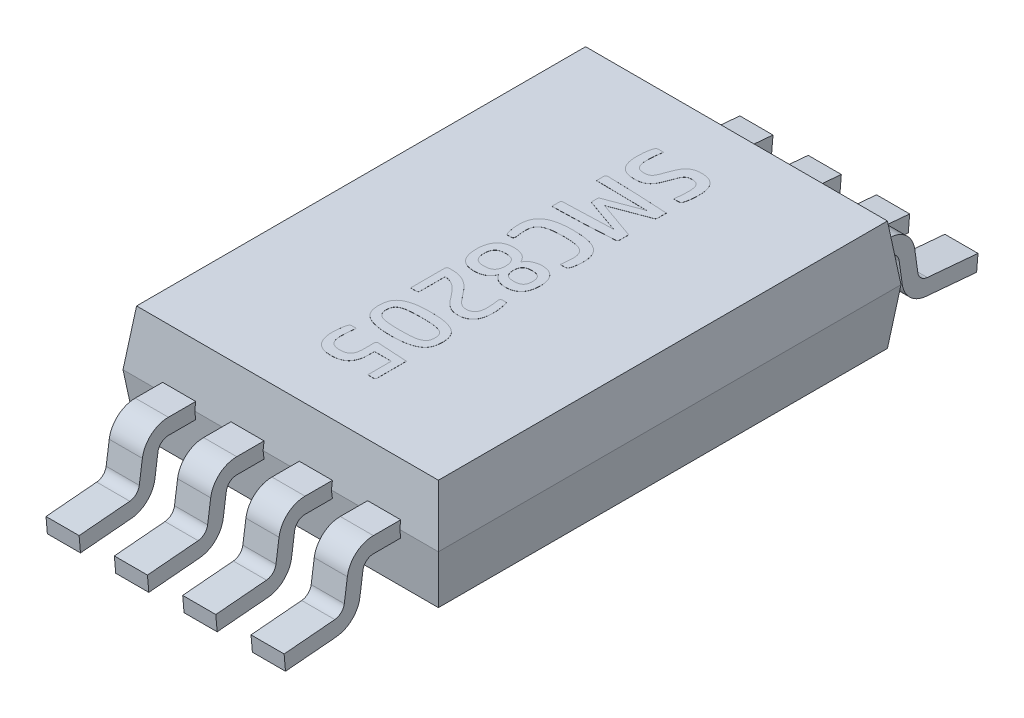
from build123d import *

# Parameters (mm, degrees)
SKETCH1_W                = 3
SKETCH1_H                = 4.4
EXTRUDE1_DEPTH           = 0.525
EXTRUDE1_TAPER           = 7
EXTRUDE1_OTHER_WAY_DEPTH = 0.525
EXTRUDE1_OTHER_WAY_TAPER = 7
EXTRUDE3_DEPTH           = 0.1575
LPATTERN1_COUNT          = 4
LPATTERN1_PITCH          = 0.65
BOSS_EXTRUDE1_DEPTH      = 0.001


with BuildPart() as part:
    # Sketch1 → Extrude1 (new body)
    with BuildSketch(Plane(origin=(0, 0, 0), x_dir=(1, 0, 0), z_dir=(0, 1, 0))):
        Rectangle(SKETCH1_W, SKETCH1_H)
    extrude(amount=EXTRUDE1_DEPTH, taper=EXTRUDE1_TAPER)

    # Sketch1 → Extrude1 other way (add)
    with BuildSketch(Plane(origin=(0, 0, 0), x_dir=(1, 0, 0), z_dir=(0, 1, 0))):
        Rectangle(SKETCH1_W, SKETCH1_H)
    extrude(amount=-EXTRUDE1_OTHER_WAY_DEPTH, taper=EXTRUDE1_OTHER_WAY_TAPER)

    # Sketch5 → Extrude3 (add, symmetric)
    with BuildSketch(Plane(origin=(0.975, 0, 0), x_dir=(0, 0, -1), z_dir=(1, 0, 0))):
        with BuildLine():
            Line((0, 0.075), (-2.450973193, 0.075))
            ThreePointArc((-2.450973193, 0.075), (-2.61498795, 0.013677395), (-2.69854021, -0.140206725))
            Line((-2.69854021, -0.140206725), (-2.727701519, -0.347700215))
            ThreePointArc((-2.727701519, -0.347700215), (-2.757892868, -0.406320342), (-2.818012751, -0.433402375))
            Line((-2.818012751, -0.433402375), (-3.3, -0.475570795))
            Line((-3.3, -0.475570795), (-3.286926639, -0.625))
            Line((-3.286926639, -0.625), (-2.80493939, -0.58283158))
            ThreePointArc((-2.80493939, -0.58283158), (-2.654639682, -0.515126498), (-2.579161308, -0.36857618))
            Line((-2.579161308, -0.36857618), (-2.55, -0.16108269))
            ThreePointArc((-2.55, -0.16108269), (-2.516579096, -0.099529042), (-2.450973193, -0.075))
            Line((-2.450973193, -0.075), (0, -0.075))
            Line((0, -0.075), (2.450973193, -0.075))
            ThreePointArc((2.450973193, -0.075), (2.516579096, -0.099529042), (2.55, -0.16108269))
            Line((2.55, -0.16108269), (2.579161308, -0.36857618))
            ThreePointArc((2.579161308, -0.36857618), (2.654639682, -0.515126498), (2.80493939, -0.58283158))
            Line((2.80493939, -0.58283158), (3.286926639, -0.625))
            Line((3.286926639, -0.625), (3.3, -0.475570795))
            Line((3.3, -0.475570795), (2.818012751, -0.433402375))
            ThreePointArc((2.818012751, -0.433402375), (2.757892868, -0.406320342), (2.727701519, -0.347700215))
            Line((2.727701519, -0.347700215), (2.69854021, -0.140206725))
            ThreePointArc((2.69854021, -0.140206725), (2.61498795, 0.013677395), (2.450973193, 0.075))
            Line((2.450973193, 0.075), (0, 0.075))
        make_face()
    extrude3 = extrude(amount=EXTRUDE3_DEPTH, both=True)

    # LPattern1: Extrude3 ×4
    with Locations(*[(-i * LPATTERN1_PITCH, 0, 0) for i in range(1, LPATTERN1_COUNT)]):
        add(extrude3)

    # Sketch6 → Boss-Extrude1 (add)
    # profile 1 of 7: a face of its own
    with BuildSketch(Plane(origin=(0, 0.525, 0), x_dir=(1, 0, 0), z_dir=(0, 1, 0))):
        with BuildLine():
            add(Edge.make_bspline(
                [(0.162381134, 1.644), (0.169054986, 1.643869102), (0.181984652, 1.643615505), (0.200714968, 1.64129083), (0.218215319, 1.637704043), (0.234512594, 1.632701821), (0.249404001, 1.625793179), (0.26309645, 1.617674346), (0.275647201, 1.608153856), (0.286680279, 1.596872091), (0.296530112, 1.584137922), (0.305035836, 1.569760509), (0.312273852, 1.553836167), (0.318175721, 1.536289554), (0.322586538, 1.517100452), (0.325777033, 1.496335871), (0.327843774, 1.473958219), (0.328033076, 1.458504837), (0.328131134, 1.4505)],
                knots=[0, 0, 0, 0, 1.095800708, 2.122962473, 3.094754318, 4.027666979, 4.915798918, 5.784359854, 6.638537801, 7.495125128, 8.368499264, 9.276966768, 10.23249998, 11.23671904, 12.312438126, 13.462383652, 14.685517265, 16, 16, 16, 16], degree=3))
            add(Edge.make_bspline(
                [(0.328131134, 1.4505), (0.327938044, 1.438240589), (0.327551018, 1.413668039), (0.324357064, 1.383382869), (0.321075141, 1.360289978), (0.31840571, 1.345001791), (0.315296382, 1.331827021), (0.312875015, 1.323823375), (0.311756134, 1.320125)],
                knots=[0, 0, 0, 0, 1.673425632, 3.354185213, 4.153136237, 4.858420781, 5.472491874, 6, 6, 6, 6], degree=3))
            add(Edge.make_bspline(
                [(0.311756134, 1.320125), (0.310745015, 1.317957822), (0.30888589, 1.313973072), (0.305284566, 1.309030144), (0.301723025, 1.305229068), (0.296439058, 1.302123932), (0.288982973, 1.300445378), (0.282926861, 1.30015305), (0.279756134, 1.3)],
                knots=[0, 0, 0, 0, 1.050800235, 1.93208732, 2.684913886, 3.327117359, 4.60059074, 6, 6, 6, 6], degree=3))
            Line((0.279756134, 1.3), (0.237756134, 1.3))
            add(Edge.make_bspline(
                [(0.237756134, 1.3), (0.239132118, 1.310661597), (0.241912861, 1.332207753), (0.24534305, 1.365030852), (0.247724931, 1.398715436), (0.247994834, 1.421495888), (0.248131134, 1.433)],
                knots=[0, 0, 0, 0, 0.966222987, 1.952652248, 2.966090828, 4, 4, 4, 4], degree=3))
            add(Edge.make_bspline(
                [(0.248131134, 1.433), (0.248052349, 1.438292897), (0.247901451, 1.448430383), (0.246954837, 1.462961946), (0.245200381, 1.476106819), (0.242882691, 1.487946568), (0.239800614, 1.498522221), (0.236461603, 1.50808634), (0.232124364, 1.516364447), (0.227382542, 1.523644758), (0.221910822, 1.529771635), (0.216063799, 1.535197968), (0.209285833, 1.539294574), (0.201962586, 1.542556408), (0.194032938, 1.545053179), (0.185487259, 1.546789387), (0.176320542, 1.547766764), (0.170008444, 1.54792069), (0.166756134, 1.548)],
                knots=[0, 0, 0, 0, 1.566546384, 3.000406381, 4.306680085, 5.489289946, 6.566592238, 7.565373354, 8.480904255, 9.325684365, 10.12960443, 10.906884774, 11.676793639, 12.460600545, 13.27569779, 14.131832139, 15.037426299, 16, 16, 16, 16], degree=3))
            add(Edge.make_bspline(
                [(0.166756134, 1.548), (0.163127735, 1.5479372), (0.15622665, 1.547817757), (0.146353953, 1.54667509), (0.13746434, 1.544850424), (0.129421004, 1.542223238), (0.122146111, 1.53864576), (0.115412304, 1.53410717), (0.109300153, 1.528360896), (0.103501411, 1.52174042), (0.098277341, 1.513919807), (0.093095072, 1.505218284), (0.088465095, 1.495258524), (0.083763411, 1.484363452), (0.079383769, 1.472149293), (0.074273756, 1.458846427), (0.069117311, 1.444031444), (0.065431371, 1.433746843), (0.063506134, 1.428375)],
                knots=[0, 0, 0, 0, 1.005517589, 1.912458331, 2.750668255, 3.517732371, 4.2512769, 4.991340343, 5.759794698, 6.57041129, 7.42587322, 8.362913622, 9.375505192, 10.467530105, 11.651811884, 12.97128634, 14.418045237, 16, 16, 16, 16], degree=3))
            add(Edge.make_bspline(
                [(0.063506134, 1.428375), (0.059244336, 1.417387998), (0.051082423, 1.396346422), (0.040130912, 1.370982501), (0.030917092, 1.352386099), (0.023110457, 1.339881484), (0.014566106, 1.328284556), (0.005226349, 1.317626031), (-0.005101865, 1.308057878), (-0.016420393, 1.299539228), (-0.029014862, 1.292499814), (-0.042685479, 1.28636692), (-0.057880853, 1.281530747), (-0.074940985, 1.27849017), (-0.093767462, 1.276233513), (-0.106986026, 1.276079956), (-0.113868866, 1.276)],
                knots=[0, 0, 0, 0, 1.935271406, 3.706303315, 4.535645432, 5.340779865, 6.123622101, 6.899313845, 7.664368764, 8.432142447, 9.219784971, 10.028517141, 10.88984803, 11.830610527, 12.870409949, 14, 14, 14, 14], degree=3))
            add(Edge.make_bspline(
                [(-0.113868866, 1.276), (-0.121375515, 1.276124358), (-0.135887705, 1.276364772), (-0.156847567, 1.27875893), (-0.176147095, 1.282707826), (-0.193845111, 1.288218871), (-0.209926025, 1.29523835), (-0.224204442, 1.304173601), (-0.236999093, 1.314396555), (-0.247950177, 1.326468266), (-0.257341689, 1.340049338), (-0.265628084, 1.354923215), (-0.272477418, 1.37130145), (-0.278046686, 1.389019889), (-0.282617647, 1.408089871), (-0.285620391, 1.428630349), (-0.287545056, 1.450588009), (-0.287758686, 1.465703955), (-0.287868866, 1.4735)],
                knots=[0, 0, 0, 0, 1.188342265, 2.297356508, 3.335190152, 4.303491238, 5.228021712, 6.105090958, 6.963495954, 7.813465647, 8.675640866, 9.573510349, 10.504890681, 11.48147431, 12.512151846, 13.606763337, 14.765688738, 16, 16, 16, 16], degree=3))
            add(Edge.make_bspline(
                [(-0.287868866, 1.4735), (-0.287623364, 1.48726096), (-0.287139333, 1.514392098), (-0.283485717, 1.547655672), (-0.279431332, 1.572539823), (-0.276389856, 1.588999203), (-0.272986496, 1.603252812), (-0.270168979, 1.611889632), (-0.268868866, 1.615875)],
                knots=[0, 0, 0, 0, 1.717853546, 3.386923788, 4.172122025, 4.865979384, 5.476718398, 6, 6, 6, 6], degree=3))
            add(Edge.make_bspline(
                [(-0.268868866, 1.615875), (-0.268126145, 1.617648822), (-0.266717359, 1.621013393), (-0.263948695, 1.625454856), (-0.260814227, 1.629003818), (-0.256172183, 1.632646323), (-0.248928741, 1.635434858), (-0.242770092, 1.635803757), (-0.239493866, 1.636)],
                knots=[0, 0, 0, 0, 0.901587979, 1.710124565, 2.444273447, 3.113266451, 4.464339599, 6, 6, 6, 6], degree=3))
            Line((-0.239493866, 1.636), (-0.194868866, 1.636))
            add(Edge.make_bspline(
                [(-0.194868866, 1.636), (-0.196341647, 1.625460327), (-0.199435849, 1.603317262), (-0.203967316, 1.568710331), (-0.207247182, 1.531226544), (-0.207657436, 1.505340648), (-0.207868866, 1.492)],
                knots=[0, 0, 0, 0, 0.882424306, 1.85390761, 2.893982154, 4, 4, 4, 4], degree=3))
            add(Edge.make_bspline(
                [(-0.207868866, 1.492), (-0.207821881, 1.486246552), (-0.207732213, 1.475266231), (-0.206382402, 1.459588534), (-0.204646573, 1.445404734), (-0.201909727, 1.432730361), (-0.198372455, 1.421501421), (-0.194324139, 1.411572225), (-0.189495082, 1.402961478), (-0.184170312, 1.395446271), (-0.177902019, 1.389287365), (-0.171147374, 1.384067553), (-0.163595072, 1.380038934), (-0.152547958, 1.375850848), (-0.137085573, 1.372624867), (-0.124302189, 1.37221453), (-0.117618866, 1.372)],
                knots=[0, 0, 0, 0, 1.389152789, 2.651165294, 3.798366943, 4.838659748, 5.777631915, 6.639260937, 7.423215906, 8.157952949, 8.85534888, 9.537696346, 10.213181377, 10.914054168, 12.386626598, 14, 14, 14, 14], degree=3))
            add(Edge.make_bspline(
                [(-0.117618866, 1.372), (-0.113866937, 1.372078385), (-0.106682261, 1.372228486), (-0.096430976, 1.373177142), (-0.087213032, 1.374906891), (-0.07892768, 1.377406469), (-0.071415661, 1.380810695), (-0.064598982, 1.385241176), (-0.058406324, 1.390670411), (-0.052861168, 1.397238739), (-0.047600962, 1.404777251), (-0.042636593, 1.413479128), (-0.037761938, 1.423247477), (-0.033015108, 1.434256461), (-0.028171908, 1.446539349), (-0.023020548, 1.460198932), (-0.01768151, 1.475353347), (-0.0140288, 1.485956045), (-0.012118866, 1.4915)],
                knots=[0, 0, 0, 0, 1.02710695, 1.966836611, 2.814645877, 3.59033533, 4.330405784, 5.064386472, 5.807964388, 6.576238868, 7.411604113, 8.321296825, 9.315972797, 10.398818814, 11.601864244, 12.930157256, 14.394835888, 16, 16, 16, 16], degree=3))
            add(Edge.make_bspline(
                [(-0.012118866, 1.4915), (-0.009990007, 1.497389319), (-0.005814615, 1.508940209), (0.000913179, 1.525550155), (0.007716071, 1.541176589), (0.014539113, 1.555835134), (0.021716623, 1.569562176), (0.029736626, 1.582116408), (0.038515657, 1.593498858), (0.047911036, 1.603892786), (0.058284602, 1.613075181), (0.06952151, 1.621278383), (0.081874783, 1.628100577), (0.095165648, 1.634005591), (0.109815726, 1.638473975), (0.125933617, 1.641676445), (0.143620842, 1.643715318), (0.155958521, 1.643902539), (0.162381134, 1.644)],
                knots=[0, 0, 0, 0, 1.188424217, 2.330890728, 3.400418439, 4.422773249, 5.399167379, 6.338045872, 7.245940875, 8.124715161, 8.992893656, 9.870813588, 10.759494654, 11.666011028, 12.626487868, 13.659370462, 14.781540918, 16, 16, 16, 16], degree=3))
        make_face()
    # profile 2 of 7: a face of its own
    with BuildSketch(Plane(origin=(0, 0.525, 0), x_dir=(1, 0, 0), z_dir=(0, 1, 0))):
        with BuildLine():
            add(Edge.make_bspline(
                [(-0.259993866, 0.748), (-0.251285612, 0.748211717), (-0.233577606, 0.748642239), (-0.206492516, 0.749236498), (-0.178409075, 0.749991303), (-0.139409952, 0.751189354), (-0.089573086, 0.752708802), (-0.029199964, 0.75485621), (0.031255968, 0.757128474), (0.090844326, 0.759292819), (0.148339425, 0.761709938), (0.185839367, 0.763252641), (0.204006134, 0.764)],
                knots=[0, 0, 0, 0, 0.562856179, 1.144553392, 1.75054106, 2.378134987, 3.665698126, 4.972275917, 6.281641263, 7.574863887, 8.825147926, 10, 10, 10, 10], degree=3))
            Line((0.204006134, 0.764), (-0.127868866, 0.8815))
            Line((-0.127868866, 0.8815), (-0.127868866, 0.937875))
            add(Edge.make_bspline(
                [(-0.127868866, 0.937875), (-0.127797072, 0.939463601), (-0.127664979, 0.942386474), (-0.126726134, 0.946392602), (-0.124925006, 0.949607736), (-0.121277668, 0.95267134), (-0.115526863, 0.95552472), (-0.11063363, 0.957457382), (-0.107993866, 0.9585)],
                knots=[0, 0, 0, 0, 0.910608881, 1.675432, 2.339186876, 2.98197576, 4.371859297, 6, 6, 6, 6], degree=3))
            Line((-0.107993866, 0.9585), (0.204006134, 1.076))
            add(Edge.make_bspline(
                [(0.204006134, 1.076), (0.185172945, 1.076423458), (0.146215522, 1.077299403), (0.086381366, 1.0785108), (0.024299427, 1.079795229), (-0.03874427, 1.080850984), (-0.101700745, 1.082048748), (-0.153703004, 1.082771992), (-0.194408656, 1.083570061), (-0.223785876, 1.083708733), (-0.252159827, 1.084068813), (-0.270743754, 1.084022662), (-0.279868866, 1.084)],
                knots=[0, 0, 0, 0, 1.167765182, 2.415582529, 3.709882819, 5.017046673, 6.324210528, 7.613252856, 8.24098726, 8.847995263, 9.434340687, 10, 10, 10, 10], degree=3))
            Line((-0.279868866, 1.084), (-0.279868866, 1.150875))
            add(Edge.make_bspline(
                [(-0.279868866, 1.150875), (-0.279700243, 1.154006614), (-0.279394095, 1.159692314), (-0.275455037, 1.167128039), (-0.268389856, 1.171436138), (-0.262972981, 1.171799927), (-0.259993866, 1.172)],
                knots=[0, 0, 0, 0, 1.129623518, 2.050922856, 2.928067463, 4, 4, 4, 4], degree=3))
            add(Edge.make_bspline(
                [(-0.259993866, 1.172), (-0.212822406, 1.171180804), (-0.118287953, 1.169539085), (0.000199461, 1.164748025), (0.095963522, 1.159943342), (0.169394688, 1.156467384), (0.244255859, 1.152201696), (0.294672452, 1.149409809), (0.320131134, 1.148)],
                knots=[0, 0, 0, 0, 1.462434002, 2.93080607, 3.675653407, 4.434754675, 5.20960381, 6, 6, 6, 6], degree=3))
            Line((0.320131134, 1.148), (0.320131134, 1.064125))
            add(Edge.make_bspline(
                [(0.320131134, 1.064125), (0.319911472, 1.061728313), (0.319476501, 1.056982441), (0.31519387, 1.050757622), (0.308732567, 1.045688999), (0.303259493, 1.043710632), (0.300256134, 1.042625)],
                knots=[0, 0, 0, 0, 0.905004721, 1.792072796, 2.788396316, 4, 4, 4, 4], degree=3))
            Line((0.300256134, 1.042625), (-0.035993866, 0.916))
            Line((-0.035993866, 0.916), (0.320131134, 0.79))
            Line((0.320131134, 0.79), (0.320131134, 0.704))
            add(Edge.make_bspline(
                [(0.320131134, 0.704), (0.32003691, 0.702376275), (0.319861424, 0.699352196), (0.319164736, 0.695083655), (0.317257145, 0.69175603), (0.314216418, 0.688050273), (0.308227046, 0.68522031), (0.303072519, 0.684431176), (0.300256134, 0.684)],
                knots=[0, 0, 0, 0, 0.919243719, 1.712029929, 2.406003926, 3.056007394, 4.391430783, 6, 6, 6, 6], degree=3))
            add(Edge.make_bspline(
                [(0.300256134, 0.684), (0.252596761, 0.680916794), (0.157227471, 0.674747112), (0.037737633, 0.668901834), (-0.058398132, 0.664982794), (-0.131404063, 0.662805577), (-0.205320367, 0.660973418), (-0.254909627, 0.660325906), (-0.279868866, 0.66)],
                knots=[0, 0, 0, 0, 1.480374188, 2.962318314, 3.708133543, 4.46275598, 5.226275204, 6, 6, 6, 6], degree=3))
            Line((-0.279868866, 0.66), (-0.279868866, 0.72725))
            add(Edge.make_bspline(
                [(-0.279868866, 0.72725), (-0.2797041, 0.730344914), (-0.27940509, 0.735961457), (-0.275408384, 0.743259276), (-0.2684036, 0.74758672), (-0.262976041, 0.747853447), (-0.259993866, 0.748)],
                knots=[0, 0, 0, 0, 1.123160969, 2.038273439, 2.922128263, 4, 4, 4, 4], degree=3))
        make_face()
    # profile 3 of 7: a face of its own
    with BuildSketch(Plane(origin=(0, 0.525, 0), x_dir=(1, 0, 0), z_dir=(0, 1, 0))):
        with BuildLine():
            add(Edge.make_bspline(
                [(0.328131134, 0.34875), (0.327868696, 0.338698818), (0.32733243, 0.318160208), (0.324254165, 0.292693822), (0.320850743, 0.272890524), (0.317892673, 0.259557673), (0.31448752, 0.247971788), (0.311679728, 0.240982515), (0.310381134, 0.23775)],
                knots=[0, 0, 0, 0, 1.6007845, 3.271047027, 4.079535555, 4.800815736, 5.445381445, 6, 6, 6, 6], degree=3))
            add(Edge.make_bspline(
                [(0.310381134, 0.23775), (0.308863503, 0.234786761), (0.306043958, 0.229281479), (0.298988764, 0.223159473), (0.289968448, 0.22053042), (0.28360191, 0.220187141), (0.280131134, 0.22)],
                knots=[0, 0, 0, 0, 1.057042048, 1.963836195, 2.889967147, 4, 4, 4, 4], degree=3))
            Line((0.280131134, 0.22), (0.238631134, 0.22))
            add(Edge.make_bspline(
                [(0.238631134, 0.22), (0.239789644, 0.22845417), (0.24222884, 0.246254087), (0.245335167, 0.274075933), (0.247742478, 0.303793266), (0.248000281, 0.324161645), (0.248131134, 0.3345)],
                knots=[0, 0, 0, 0, 0.890459733, 1.87482745, 2.921328576, 4, 4, 4, 4], degree=3))
            add(Edge.make_bspline(
                [(0.248131134, 0.3345), (0.248029153, 0.340464181), (0.247832403, 0.351970669), (0.245831316, 0.368509664), (0.242489112, 0.383645971), (0.23776144, 0.397411428), (0.2314799, 0.409929411), (0.223225544, 0.421118107), (0.212948637, 0.430870458), (0.20090313, 0.439508012), (0.186744451, 0.446731728), (0.170555849, 0.453002872), (0.152089768, 0.457873735), (0.131444023, 0.461719504), (0.108347515, 0.46449791), (0.082664271, 0.466602004), (0.054226533, 0.467835632), (0.034382363, 0.467943564), (0.024006134, 0.468)],
                knots=[0, 0, 0, 0, 0.94861722, 1.830134408, 2.64557958, 3.41086469, 4.140245129, 4.865546649, 5.611049093, 6.385582352, 7.215876383, 8.133093109, 9.143084958, 10.249598737, 11.472366676, 12.842714107, 14.349100941, 16, 16, 16, 16], degree=3))
            add(Edge.make_bspline(
                [(0.024006134, 0.468), (0.012587141, 0.46792624), (-0.009180379, 0.467785635), (-0.040162468, 0.466142033), (-0.067867396, 0.463605009), (-0.092374797, 0.460030396), (-0.114040803, 0.455453948), (-0.133009028, 0.449728326), (-0.149617736, 0.443218834), (-0.163673458, 0.435400343), (-0.175547412, 0.42657421), (-0.18528496, 0.416611487), (-0.193115548, 0.405536458), (-0.198826697, 0.39325101), (-0.202920635, 0.379930677), (-0.205750134, 0.365556982), (-0.207512282, 0.350043562), (-0.207747479, 0.339296571), (-0.207868866, 0.33375)],
                knots=[0, 0, 0, 0, 1.776309616, 3.386100147, 4.825117375, 6.103046459, 7.237152062, 8.266576258, 9.182608719, 10.006765214, 10.761293373, 11.476393937, 12.16515534, 12.861048068, 13.574501474, 14.328361071, 15.137259569, 16, 16, 16, 16], degree=3))
            add(Edge.make_bspline(
                [(-0.207868866, 0.33375), (-0.207840547, 0.328081475), (-0.207785538, 0.317070474), (-0.206803995, 0.301154559), (-0.205701407, 0.286329069), (-0.203719608, 0.272817576), (-0.201757973, 0.260688059), (-0.20041103, 0.250057888), (-0.199399589, 0.241019234), (-0.199292453, 0.23550211), (-0.199243866, 0.233)],
                knots=[0, 0, 0, 0, 1.343555596, 2.6098311, 3.779615241, 4.8664665, 5.845786097, 6.69241919, 7.406989792, 8, 8, 8, 8], degree=3))
            add(Edge.make_bspline(
                [(-0.199243866, 0.233), (-0.199396303, 0.22990104), (-0.199676827, 0.224198173), (-0.203965604, 0.216791062), (-0.21138172, 0.212581122), (-0.217020639, 0.212206068), (-0.220118866, 0.212)],
                knots=[0, 0, 0, 0, 1.09175802, 2.009109741, 2.906132495, 4, 4, 4, 4], degree=3))
            Line((-0.220118866, 0.212), (-0.263243866, 0.212))
            add(Edge.make_bspline(
                [(-0.263243866, 0.212), (-0.264814877, 0.216323061), (-0.268087314, 0.225328055), (-0.272578668, 0.23952825), (-0.276669261, 0.255018773), (-0.280594944, 0.2717011), (-0.283849544, 0.289712657), (-0.28622476, 0.30903002), (-0.287567763, 0.329689157), (-0.287766427, 0.343914729), (-0.287868866, 0.35125)],
                knots=[0, 0, 0, 0, 0.77618087, 1.616794973, 2.512260386, 3.479371335, 4.508284646, 5.59935148, 6.762130194, 8, 8, 8, 8], degree=3))
            add(Edge.make_bspline(
                [(-0.287868866, 0.35125), (-0.287655758, 0.360301512), (-0.287242809, 0.377841067), (-0.284002, 0.403094961), (-0.278634601, 0.426353144), (-0.271178523, 0.447700588), (-0.261234018, 0.467247916), (-0.248610971, 0.484835079), (-0.233534927, 0.500682073), (-0.215830924, 0.514639247), (-0.19550339, 0.526702382), (-0.172783509, 0.537321613), (-0.147332715, 0.545628409), (-0.119386985, 0.552544093), (-0.088620839, 0.557680581), (-0.054984563, 0.561353184), (-0.018399706, 0.563612959), (0.006961069, 0.563867707), (0.020131134, 0.564)],
                knots=[0, 0, 0, 0, 1.009368617, 1.955902649, 2.834078274, 3.667532267, 4.471921075, 5.271502534, 6.073592258, 6.903930621, 7.777482452, 8.704848362, 9.69540353, 10.758334518, 11.913575116, 13.171495865, 14.53113388, 16, 16, 16, 16], degree=3))
            add(Edge.make_bspline(
                [(0.020131134, 0.564), (0.033426715, 0.56387087), (0.059079865, 0.563621721), (0.095986056, 0.561317279), (0.129938072, 0.557856212), (0.160864055, 0.552584068), (0.189082639, 0.546026716), (0.214439482, 0.537317871), (0.237293327, 0.527215817), (0.257295821, 0.514970832), (0.274897008, 0.501152844), (0.289705674, 0.485233829), (0.302212182, 0.467567917), (0.311772678, 0.447770062), (0.319247433, 0.426076304), (0.324311628, 0.402229935), (0.32769339, 0.376221646), (0.327981562, 0.358136743), (0.328131134, 0.34875)],
                knots=[0, 0, 0, 0, 1.471259446, 2.838720623, 4.090928081, 5.246263844, 6.308781896, 7.293104508, 8.209404844, 9.068267905, 9.882051574, 10.678082438, 11.466112789, 12.268330256, 13.102475532, 13.999770062, 14.961805709, 16, 16, 16, 16], degree=3))
        make_face()
    # profile 4 of 7: a face of its own
    with BuildSketch(Plane(origin=(0, 0.525, 0), x_dir=(1, 0, 0), z_dir=(0, 1, 0))):
        with BuildLine():
            add(Edge.make_bspline(
                [(-0.287868866, -0.052875), (-0.287770262, -0.045369506), (-0.287578701, -0.030788406), (-0.285484314, -0.009582839), (-0.282364774, 0.010336955), (-0.277660213, 0.028859367), (-0.272012416, 0.046182143), (-0.26471824, 0.062066893), (-0.256168609, 0.076677217), (-0.246439009, 0.090018649), (-0.235260127, 0.101917899), (-0.222500984, 0.112029778), (-0.208482625, 0.120778018), (-0.192995028, 0.12792314), (-0.176069703, 0.133377696), (-0.157757945, 0.137203027), (-0.138101269, 0.139638518), (-0.124501417, 0.139877078), (-0.117493866, 0.14)],
                knots=[0, 0, 0, 0, 1.223197873, 2.376335406, 3.470755286, 4.507049109, 5.4887382, 6.437148072, 7.350537411, 8.24452331, 9.123859322, 10.003326514, 10.891148884, 11.812034837, 12.776558218, 13.783790964, 14.858061268, 16, 16, 16, 16], degree=3))
            add(Edge.make_bspline(
                [(-0.117493866, 0.14), (-0.109436984, 0.139768564), (-0.093779211, 0.13931879), (-0.071050263, 0.135578156), (-0.049760828, 0.129662287), (-0.033197765, 0.122475646), (-0.020731084, 0.115524911), (-0.011931326, 0.109230909), (-0.003745873, 0.10188889), (0.004249365, 0.093945319), (0.011477149, 0.084794767), (0.018338405, 0.074823215), (0.024745278, 0.063924652), (0.028476853, 0.056194709), (0.030381134, 0.05225)],
                knots=[0, 0, 0, 0, 1.5812619, 3.073030144, 4.510495738, 5.910398705, 6.606598035, 7.310448137, 8.02935556, 8.764151086, 9.52062956, 10.314966935, 11.140101527, 12, 12, 12, 12], degree=3))
            add(Edge.make_bspline(
                [(0.030381134, 0.05225), (0.033802126, 0.058346795), (0.040484015, 0.070255068), (0.053769974, 0.085466592), (0.068812843, 0.098196133), (0.08604873, 0.107658801), (0.10432737, 0.114936301), (0.123390276, 0.120248487), (0.143104397, 0.123463801), (0.156494149, 0.123820077), (0.163256134, 0.124)],
                knots=[0, 0, 0, 0, 1.050819385, 2.052462756, 3.02424966, 4.005380205, 4.999777286, 5.983715651, 6.981752326, 8, 8, 8, 8], degree=3))
            add(Edge.make_bspline(
                [(0.163256134, 0.124), (0.169347296, 0.123911233), (0.181235978, 0.123737978), (0.198489163, 0.121486557), (0.214774162, 0.118236857), (0.229895031, 0.113284693), (0.244066646, 0.107229305), (0.256959174, 0.09950623), (0.268887609, 0.090567813), (0.279612657, 0.080177803), (0.289233124, 0.068401506), (0.297594006, 0.055276883), (0.304634824, 0.04071003), (0.310366195, 0.024832006), (0.314675779, 0.007516395), (0.317939857, -0.011062594), (0.319794995, -0.031087297), (0.32001655, -0.044871206), (0.320131134, -0.052)],
                knots=[0, 0, 0, 0, 1.084925078, 2.117548546, 3.096344745, 4.040492395, 4.948397222, 5.837425265, 6.712288486, 7.59991954, 8.491889598, 9.416916277, 10.36685871, 11.370005064, 12.420132993, 13.543423015, 14.729501814, 16, 16, 16, 16], degree=3))
            add(Edge.make_bspline(
                [(0.320131134, -0.052), (0.320012214, -0.059086603), (0.319780927, -0.072869302), (0.317968982, -0.092859319), (0.314631715, -0.111463561), (0.310425627, -0.128769289), (0.304560315, -0.14463422), (0.297681493, -0.159245502), (0.289136421, -0.17228698), (0.279713672, -0.184190317), (0.268787574, -0.194406804), (0.257052857, -0.203564356), (0.243983798, -0.21102565), (0.229963476, -0.217380231), (0.214722323, -0.222005002), (0.198523735, -0.225596607), (0.181218674, -0.227520129), (0.169343614, -0.227837372), (0.163256134, -0.228)],
                knots=[0, 0, 0, 0, 1.263362421, 2.457107064, 3.573335905, 4.630901787, 5.627295531, 6.584138434, 7.503122408, 8.401059894, 9.283750732, 10.163310341, 11.048778661, 11.959893108, 12.902003519, 13.882571401, 14.91454818, 16, 16, 16, 16], degree=3))
            add(Edge.make_bspline(
                [(0.163256134, -0.228), (0.156494472, -0.22781922), (0.143105357, -0.227461247), (0.123386546, -0.224258406), (0.104356059, -0.218903684), (0.086025279, -0.211808922), (0.068771857, -0.20232341), (0.053810474, -0.18946113), (0.04047792, -0.174261941), (0.033800062, -0.162349122), (0.030381134, -0.15625)],
                knots=[0, 0, 0, 0, 1.018030622, 2.015854554, 2.99958318, 3.991447537, 4.972368941, 5.947974751, 6.94940461, 8, 8, 8, 8], degree=3))
            add(Edge.make_bspline(
                [(0.030381134, -0.15625), (0.02847994, -0.160196869), (0.024754412, -0.167931042), (0.018316107, -0.17877904), (0.011624531, -0.188840561), (0.00436034, -0.197892929), (-0.003488804, -0.205937089), (-0.011675309, -0.213185251), (-0.02034806, -0.219527855), (-0.032685952, -0.226494554), (-0.049169818, -0.233678313), (-0.070543098, -0.23962393), (-0.093491795, -0.243303704), (-0.109354605, -0.243763882), (-0.117493866, -0.244)],
                knots=[0, 0, 0, 0, 0.859253462, 1.683769119, 2.472907508, 3.228818546, 3.957350629, 4.675718799, 5.372404102, 6.060982526, 7.452336746, 8.888724094, 10.40359398, 12, 12, 12, 12], degree=3))
            add(Edge.make_bspline(
                [(-0.117493866, -0.244), (-0.124502581, -0.243882011), (-0.138104692, -0.243653025), (-0.157737, -0.241151471), (-0.176095553, -0.237562042), (-0.192928875, -0.231977647), (-0.208508933, -0.225191492), (-0.22249505, -0.216525166), (-0.235216441, -0.206552091), (-0.246434522, -0.19490508), (-0.256200987, -0.181788046), (-0.264713748, -0.167317013), (-0.272011229, -0.151560034), (-0.277682301, -0.134324502), (-0.2823464, -0.115875063), (-0.285488287, -0.096043598), (-0.287581957, -0.074920114), (-0.287771185, -0.060380499), (-0.287868866, -0.052875)],
                knots=[0, 0, 0, 0, 1.146775367, 2.2255957, 3.235690366, 4.204298947, 5.123432124, 6.011432324, 6.890372673, 7.763576237, 8.650396544, 9.561775973, 10.508001829, 11.487384339, 12.528067342, 13.620390868, 14.771621322, 16, 16, 16, 16], degree=3))
        make_face()
        with BuildLine():
            add(Edge.make_bspline(
                [(-0.215868866, -0.052), (-0.215801672, -0.056086186), (-0.215671127, -0.064024891), (-0.214526192, -0.075554754), (-0.212692934, -0.086347991), (-0.210031833, -0.096362035), (-0.206830684, -0.105747823), (-0.202700443, -0.114310071), (-0.19789357, -0.122219483), (-0.192298513, -0.129388619), (-0.185678603, -0.135660451), (-0.178278902, -0.141317516), (-0.169653142, -0.145698556), (-0.16017265, -0.149518136), (-0.149694634, -0.152469318), (-0.138231601, -0.154576327), (-0.125813789, -0.155832294), (-0.117205235, -0.155942754), (-0.112743866, -0.156)],
                knots=[0, 0, 0, 0, 1.161428387, 2.256440692, 3.290555951, 4.270322845, 5.199441391, 6.105467887, 6.966875467, 7.827142001, 8.681680453, 9.553531681, 10.464962729, 11.421833357, 12.456694657, 13.553307624, 14.732005486, 16, 16, 16, 16], degree=3))
            add(Edge.make_bspline(
                [(-0.112743866, -0.156), (-0.105694796, -0.155809504), (-0.091898633, -0.155436671), (-0.074962579, -0.152948674), (-0.062319454, -0.149414237), (-0.053473048, -0.146126434), (-0.045484391, -0.141665384), (-0.038040529, -0.136507201), (-0.031389254, -0.130189865), (-0.025426419, -0.122719992), (-0.020407756, -0.114011422), (-0.01577315, -0.104296963), (-0.012176965, -0.093169988), (-0.009599479, -0.08068493), (-0.008124938, -0.066785261), (-0.007956969, -0.057086961), (-0.007868866, -0.052)],
                knots=[0, 0, 0, 0, 1.730043818, 3.385974312, 4.18238221, 4.949566993, 5.695467641, 6.421765796, 7.166824886, 7.938155358, 8.758874788, 9.628041893, 10.575487977, 11.62034148, 12.751819224, 14, 14, 14, 14], degree=3))
            add(Edge.make_bspline(
                [(-0.007868866, -0.052), (-0.007957863, -0.046913149), (-0.008127537, -0.03721506), (-0.009586224, -0.023354575), (-0.012188141, -0.010913347), (-0.015810785, 0.000194516), (-0.020335316, 0.009967638), (-0.02547178, 0.018608302), (-0.031377502, 0.026077008), (-0.038082483, 0.032365731), (-0.045440462, 0.037686628), (-0.053481916, 0.042107527), (-0.062296673, 0.045453587), (-0.075009453, 0.048712745), (-0.091875652, 0.051515434), (-0.105689244, 0.05183619), (-0.112743866, 0.052)],
                knots=[0, 0, 0, 0, 1.248594749, 2.380447761, 3.4156394, 4.363399715, 5.242131936, 6.054346767, 6.825933059, 7.571239257, 8.303730401, 9.049878436, 9.817317664, 10.611292788, 12.269382393, 14, 14, 14, 14], degree=3))
            add(Edge.make_bspline(
                [(-0.112743866, 0.052), (-0.117205286, 0.051942846), (-0.125813937, 0.051832563), (-0.138231075, 0.050575364), (-0.149696417, 0.048472577), (-0.16016659, 0.045507065), (-0.169691842, 0.041728467), (-0.178242546, 0.037168554), (-0.185690797, 0.031549821), (-0.192246367, 0.025263498), (-0.197979525, 0.018196276), (-0.20262048, 0.010222765), (-0.206870759, 0.001727029), (-0.210023783, -0.007642226), (-0.21269527, -0.017650773), (-0.214525514, -0.028445605), (-0.215671312, -0.039975011), (-0.215801735, -0.04791378), (-0.215868866, -0.052)],
                knots=[0, 0, 0, 0, 1.268328545, 2.447336915, 3.544238765, 4.579372682, 5.536495381, 6.453770254, 7.325851156, 8.180614721, 9.031839559, 9.903598422, 10.799188906, 11.728552212, 12.708577209, 13.742964888, 14.838265654, 16, 16, 16, 16], degree=3))
        make_face(mode=Mode.SUBTRACT)
        with BuildLine():
            add(Edge.make_bspline(
                [(0.064131134, -0.052), (0.064214382, -0.056547019), (0.064373742, -0.06525133), (0.065909257, -0.077584012), (0.068154399, -0.088620993), (0.071685409, -0.098237554), (0.076171603, -0.106514504), (0.081009592, -0.113925001), (0.086654031, -0.120156702), (0.092858485, -0.125414884), (0.099722161, -0.129504599), (0.107038094, -0.132941665), (0.114897995, -0.135519709), (0.126012176, -0.138009785), (0.14038495, -0.139447605), (0.151962894, -0.139815778), (0.157756134, -0.14)],
                knots=[0, 0, 0, 0, 1.278910484, 2.448204724, 3.492342986, 4.442014336, 5.317960526, 6.137469475, 6.926203741, 7.675334996, 8.417367068, 9.167507007, 9.946154181, 10.739754004, 12.368675188, 14, 14, 14, 14], degree=3))
            add(Edge.make_bspline(
                [(0.157756134, -0.14), (0.161550102, -0.139924377), (0.16886013, -0.139778669), (0.179428021, -0.138769495), (0.189203444, -0.137153418), (0.198237039, -0.134983137), (0.206424955, -0.131933761), (0.213851817, -0.128312845), (0.220570904, -0.124052794), (0.226506447, -0.119007309), (0.231636478, -0.11321438), (0.236105536, -0.106715616), (0.239812557, -0.099424679), (0.242962994, -0.091401158), (0.245323139, -0.082594543), (0.246890105, -0.073045392), (0.24790921, -0.062771775), (0.248055539, -0.055669237), (0.248131134, -0.052)],
                knots=[0, 0, 0, 0, 1.249393875, 2.407270013, 3.492361413, 4.510763013, 5.461560357, 6.363680725, 7.227740332, 8.07463148, 8.920187539, 9.768966468, 10.665013293, 11.607855699, 12.603160864, 13.661190997, 14.791749457, 16, 16, 16, 16], degree=3))
            add(Edge.make_bspline(
                [(0.248131134, -0.052), (0.24805561, -0.048330722), (0.247909418, -0.041228104), (0.246889355, -0.030955044), (0.245325692, -0.021403973), (0.242954268, -0.012603914), (0.239855998, -0.004592369), (0.236022015, 0.002621224), (0.231725367, 0.009200801), (0.226453338, 0.014876282), (0.220583191, 0.019943355), (0.213816236, 0.024160838), (0.206462208, 0.027965973), (0.198231229, 0.030971745), (0.189205158, 0.033156779), (0.179427518, 0.034768509), (0.168860271, 0.035778946), (0.16155015, 0.035924471), (0.157756134, 0.036)],
                knots=[0, 0, 0, 0, 1.208618712, 2.339521666, 3.397874194, 4.393482641, 5.336612342, 6.220762724, 7.081152887, 7.916769622, 8.763918828, 9.628241724, 10.536775439, 11.487862503, 12.506574422, 13.591996463, 14.75022542, 16, 16, 16, 16], degree=3))
            add(Edge.make_bspline(
                [(0.157756134, 0.036), (0.151958789, 0.035841126), (0.140367692, 0.035523477), (0.126049895, 0.03377089), (0.114879018, 0.031562111), (0.107045636, 0.028922022), (0.099682887, 0.025529318), (0.09289121, 0.021274259), (0.086692259, 0.016042783), (0.080969272, 0.009919054), (0.076178483, 0.002508649), (0.071683343, -0.005760688), (0.068155032, -0.015379546), (0.065909058, -0.026415819), (0.0643738, -0.038748719), (0.064214402, -0.047452997), (0.064131134, -0.052)],
                knots=[0, 0, 0, 0, 1.631746591, 3.262481298, 4.053769728, 4.832618221, 5.582952109, 6.331358649, 7.080683591, 7.860943682, 8.680664516, 9.556837181, 10.506754069, 11.551162293, 12.720758854, 14, 14, 14, 14], degree=3))
        make_face(mode=Mode.SUBTRACT)
    # profile 5 of 7: a face of its own
    with BuildSketch(Plane(origin=(0, 0.525, 0), x_dir=(1, 0, 0), z_dir=(0, 1, 0))):
        with BuildLine():
            add(Edge.make_bspline(
                [(-0.015868866, -0.56375), (-0.021853772, -0.556154421), (-0.033960691, -0.540789258), (-0.052539087, -0.517793642), (-0.072253766, -0.495247739), (-0.090647788, -0.478194677), (-0.106260219, -0.465558334), (-0.118771483, -0.457118954), (-0.131856157, -0.449474036), (-0.145458803, -0.44249553), (-0.159890401, -0.436764954), (-0.175069835, -0.432141125), (-0.191198643, -0.42934411), (-0.202234935, -0.42845426), (-0.207868866, -0.428)],
                knots=[0, 0, 0, 0, 1.428359033, 2.889440026, 4.367084535, 5.847686961, 6.587809064, 7.332090694, 8.074155109, 8.825578603, 9.587887601, 10.36486341, 11.16527715, 12, 12, 12, 12], degree=3))
            Line((-0.207868866, -0.428), (-0.207868866, -0.664))
            add(Edge.make_bspline(
                [(-0.207868866, -0.664), (-0.208061526, -0.666957669), (-0.208410324, -0.672312327), (-0.212106876, -0.67948605), (-0.219028371, -0.683481652), (-0.224278234, -0.683818004), (-0.227118866, -0.684)],
                knots=[0, 0, 0, 0, 1.11701338, 2.02227675, 2.929880194, 4, 4, 4, 4], degree=3))
            Line((-0.227118866, -0.684), (-0.279868866, -0.684))
            Line((-0.279868866, -0.684), (-0.279868866, -0.362375))
            add(Edge.make_bspline(
                [(-0.279868866, -0.362375), (-0.27965248, -0.3593913), (-0.279233416, -0.353612915), (-0.275314349, -0.347345067), (-0.271259591, -0.343495912), (-0.267459531, -0.341454366), (-0.263121438, -0.340147937), (-0.260004276, -0.340050907), (-0.258368866, -0.34)],
                knots=[0, 0, 0, 0, 1.524527026, 2.952476936, 3.683351624, 4.395947543, 5.158438745, 6, 6, 6, 6], degree=3))
            Line((-0.258368866, -0.34), (-0.226493866, -0.34))
            add(Edge.make_bspline(
                [(-0.226493866, -0.34), (-0.219321984, -0.340149194), (-0.205279333, -0.340441319), (-0.184753556, -0.342572097), (-0.165254378, -0.346152166), (-0.146838265, -0.351383045), (-0.12933354, -0.357594748), (-0.112734389, -0.364917333), (-0.096951579, -0.373124841), (-0.082087005, -0.382453253), (-0.067861367, -0.392517857), (-0.054274568, -0.403344077), (-0.041313947, -0.415056142), (-0.024858874, -0.431819075), (-0.005176726, -0.454095915), (0.009246988, -0.473073825), (0.016506134, -0.482625)],
                knots=[0, 0, 0, 0, 1.02449689, 2.0059799, 2.944667503, 3.853121336, 4.738062209, 5.596333274, 6.443048805, 7.277220957, 8.101392939, 8.931583746, 9.757666791, 10.59531503, 12.28649514, 14, 14, 14, 14], degree=3))
            add(Edge.make_bspline(
                [(0.016506134, -0.482625), (0.020200912, -0.487344095), (0.027349665, -0.496474724), (0.037920205, -0.509519271), (0.047488447, -0.521838876), (0.059105868, -0.536392849), (0.072673024, -0.552481024), (0.086647996, -0.566403035), (0.097650205, -0.575648322), (0.105782803, -0.5812727), (0.114013599, -0.585973958), (0.122434518, -0.589808799), (0.131394541, -0.592566083), (0.140856035, -0.594512633), (0.150968958, -0.595842504), (0.15791828, -0.595946373), (0.161506134, -0.596)],
                knots=[0, 0, 0, 0, 1.311243482, 2.537028532, 3.673165701, 4.723838601, 6.611395703, 8.274505239, 9.032009253, 9.752690309, 10.434501818, 11.103703754, 11.77259517, 12.480595995, 13.215549348, 14, 14, 14, 14], degree=3))
            add(Edge.make_bspline(
                [(0.161506134, -0.596), (0.164886198, -0.595945643), (0.171462824, -0.59583988), (0.180990387, -0.594512734), (0.189948249, -0.59260604), (0.198212989, -0.589605601), (0.206093728, -0.58622316), (0.213199604, -0.581629537), (0.219748294, -0.576361913), (0.225730773, -0.570288109), (0.231053753, -0.563161799), (0.235693399, -0.554849905), (0.239483993, -0.545277511), (0.242753632, -0.534628735), (0.245222768, -0.522786967), (0.2469322, -0.509792965), (0.247904344, -0.495598139), (0.248053486, -0.485751515), (0.248131134, -0.480625)],
                knots=[0, 0, 0, 0, 0.979638533, 1.906092976, 2.785719186, 3.630444402, 4.452648903, 5.267447211, 6.075314004, 6.887238868, 7.733260007, 8.647733076, 9.639743986, 10.714040597, 11.875556437, 13.143839743, 14.512977893, 16, 16, 16, 16], degree=3))
            add(Edge.make_bspline(
                [(0.248131134, -0.480625), (0.248096059, -0.473998919), (0.248028301, -0.461198759), (0.247152005, -0.442768387), (0.245707617, -0.425828318), (0.243559496, -0.410598406), (0.241220944, -0.39728879), (0.240029604, -0.385999669), (0.238783763, -0.377025752), (0.238676823, -0.371752802), (0.238631134, -0.3695)],
                knots=[0, 0, 0, 0, 1.423952067, 2.750768465, 3.96445532, 5.076386509, 6.055430827, 6.867375086, 7.51610034, 8, 8, 8, 8], degree=3))
            add(Edge.make_bspline(
                [(0.238631134, -0.3695), (0.238711905, -0.367664683), (0.238863795, -0.364213325), (0.239726098, -0.359451079), (0.241576172, -0.355626679), (0.244798787, -0.351658387), (0.250809921, -0.348477283), (0.25609204, -0.34816493), (0.258881134, -0.348)],
                knots=[0, 0, 0, 0, 0.97599498, 1.835381331, 2.548032759, 3.208243802, 4.525881164, 6, 6, 6, 6], degree=3))
            Line((0.258881134, -0.348), (0.296131134, -0.348))
            add(Edge.make_bspline(
                [(0.296131134, -0.348), (0.29767631, -0.352569329), (0.30092515, -0.362176664), (0.305096101, -0.377592117), (0.309098359, -0.394642816), (0.312816598, -0.413269139), (0.316126716, -0.433384847), (0.318463593, -0.454829268), (0.319829214, -0.477523777), (0.32002876, -0.493039757), (0.320131134, -0.501)],
                knots=[0, 0, 0, 0, 0.743988976, 1.564289166, 2.462377051, 3.445678908, 4.494002254, 5.606351308, 6.771974133, 8, 8, 8, 8], degree=3))
            add(Edge.make_bspline(
                [(0.320131134, -0.501), (0.320014874, -0.508545043), (0.319789676, -0.523159903), (0.31795568, -0.544350715), (0.314677976, -0.563967068), (0.310394017, -0.582163969), (0.304616588, -0.598749238), (0.297827012, -0.613938256), (0.289444263, -0.627429982), (0.279946553, -0.639489483), (0.26926843, -0.650059539), (0.257489552, -0.659096439), (0.244857187, -0.666936791), (0.231094397, -0.673178743), (0.216421938, -0.678034785), (0.200775133, -0.681587062), (0.184096583, -0.683524104), (0.172635838, -0.683838636), (0.166756134, -0.684)],
                knots=[0, 0, 0, 0, 1.328919921, 2.574137535, 3.742101171, 4.82972985, 5.86259118, 6.831406478, 7.754088045, 8.652725222, 9.52979451, 10.392997196, 11.262789311, 12.142923999, 13.048071177, 13.98105749, 14.964222301, 16, 16, 16, 16], degree=3))
            add(Edge.make_bspline(
                [(0.166756134, -0.684), (0.161292902, -0.683878147), (0.15071211, -0.68364215), (0.13527563, -0.681868887), (0.120833004, -0.67892535), (0.107306879, -0.674723756), (0.09456307, -0.669556731), (0.082485486, -0.663414005), (0.070878034, -0.656475916), (0.056015975, -0.646146611), (0.038710646, -0.630935613), (0.019784048, -0.61013722), (0.002018084, -0.587274977), (-0.009841705, -0.571676942), (-0.015868866, -0.56375)],
                knots=[0, 0, 0, 0, 0.85933884, 1.664305156, 2.44079687, 3.174788605, 3.889320816, 4.601684853, 5.304301042, 6.015306612, 7.446564303, 8.917135948, 10.433284486, 12, 12, 12, 12], degree=3))
        make_face()
    # profile 6 of 7: a face of its own
    with BuildSketch(Plane(origin=(0, 0.525, 0), x_dir=(1, 0, 0), z_dir=(0, 1, 0))):
        with BuildLine():
            add(Edge.make_bspline(
                [(0.016131134, -0.788), (0.023589918, -0.78805501), (0.038176733, -0.788162591), (0.059555797, -0.788796786), (0.079894098, -0.789782784), (0.099237912, -0.791134893), (0.117547438, -0.792953917), (0.134860959, -0.795435166), (0.151198163, -0.797921623), (0.171144846, -0.802075383), (0.194096631, -0.808010671), (0.219132661, -0.816820588), (0.241178858, -0.826980386), (0.260004317, -0.838950182), (0.27594059, -0.852316691), (0.28925143, -0.866881143), (0.299845167, -0.882852829), (0.307500343, -0.900236792), (0.31327416, -0.918625127), (0.317156106, -0.938121838), (0.319800684, -0.958677437), (0.320019285, -0.972782841), (0.320131134, -0.98)],
                knots=[0, 0, 0, 0, 1.085930432, 2.123706259, 3.113698773, 4.050284779, 4.946657268, 5.791700037, 6.596527662, 7.351991645, 8.757181675, 10.044618354, 11.211489036, 12.283452649, 13.282308101, 14.231461578, 15.146745204, 16.058968077, 16.987563515, 17.947664825, 18.949903993, 20, 20, 20, 20], degree=3))
            add(Edge.make_bspline(
                [(0.320131134, -0.98), (0.320007182, -0.987215703), (0.319765011, -1.00131334), (0.317286721, -1.021916782), (0.313491577, -1.041426031), (0.30807613, -1.059883172), (0.300401214, -1.077116339), (0.29019412, -1.093145613), (0.276964741, -1.107503622), (0.261264664, -1.120697661), (0.24255436, -1.132364019), (0.22080643, -1.142733422), (0.195785752, -1.151468529), (0.172854305, -1.157542538), (0.152862401, -1.161796632), (0.136470591, -1.16453817), (0.119025146, -1.166702655), (0.100536057, -1.16877666), (0.080939468, -1.170238708), (0.060263829, -1.171198945), (0.038551721, -1.171838657), (0.023714929, -1.171945426), (0.016131134, -1.172)],
                knots=[0, 0, 0, 0, 1.048863082, 2.049210109, 3.012919672, 3.936855516, 4.839994036, 5.747593127, 6.687073957, 7.667683216, 8.721661754, 9.88429237, 11.164509046, 12.56960475, 13.331348516, 14.136212492, 14.985466637, 15.887445865, 16.841506987, 17.84244105, 18.897168234, 20, 20, 20, 20], degree=3))
            add(Edge.make_bspline(
                [(0.016131134, -1.172), (0.008547341, -1.171945411), (-0.006289447, -1.171838615), (-0.028001581, -1.1711991), (-0.048677131, -1.170238169), (-0.068274027, -1.168778527), (-0.086803128, -1.166691631), (-0.104293142, -1.164549823), (-0.120725129, -1.161795898), (-0.140716402, -1.157540961), (-0.163615561, -1.151493947), (-0.188579335, -1.142711374), (-0.210312204, -1.132329576), (-0.229102999, -1.12073002), (-0.244830878, -1.107542213), (-0.257924447, -1.093102146), (-0.268144846, -1.077121555), (-0.275812246, -1.059881744), (-0.281229766, -1.041426435), (-0.285024323, -1.021916668), (-0.287502777, -1.001313371), (-0.287744925, -0.987215713), (-0.287868866, -0.98)],
                knots=[0, 0, 0, 0, 1.102755885, 2.157410496, 3.158275689, 4.112271165, 5.014188332, 5.869392959, 6.674201555, 7.435892908, 8.840891933, 10.115315737, 11.277866357, 12.336897436, 13.317439222, 14.252802343, 15.160338986, 16.063415365, 16.987287635, 17.95093089, 18.951209086, 20, 20, 20, 20], degree=3))
            add(Edge.make_bspline(
                [(-0.287868866, -0.98), (-0.287744146, -0.972784403), (-0.287500475, -0.958686972), (-0.28503777, -0.938122692), (-0.281216579, -0.918658112), (-0.275783409, -0.900215523), (-0.268184187, -0.882900851), (-0.257888938, -0.866885029), (-0.244809218, -0.852326572), (-0.229112255, -0.838914227), (-0.210417268, -0.82698312), (-0.188531082, -0.816846539), (-0.163642206, -0.807966437), (-0.140720124, -0.802051699), (-0.120724286, -0.797938911), (-0.10426898, -0.795409632), (-0.08682451, -0.792969034), (-0.06826847, -0.791119164), (-0.048672691, -0.789791006), (-0.028001984, -0.788792456), (-0.006289339, -0.788163656), (0.008547378, -0.788055357), (0.016131134, -0.788)],
                knots=[0, 0, 0, 0, 1.048173325, 2.047862499, 3.004999995, 3.928328236, 4.836401083, 5.743403315, 6.682734834, 7.670525048, 8.73542523, 9.894684896, 11.168358245, 12.570975431, 13.330989064, 14.134343082, 14.989837361, 15.890592723, 16.843584088, 17.843859913, 18.897893482, 20, 20, 20, 20], degree=3))
        make_face()
        with BuildLine():
            add(Edge.make_bspline(
                [(0.016131134, -0.876), (0.005797061, -0.876031919), (-0.014041859, -0.876093195), (-0.04254814, -0.876998428), (-0.06855545, -0.878351154), (-0.092125834, -0.880129914), (-0.113414017, -0.882717565), (-0.132507477, -0.886146473), (-0.149556369, -0.890461007), (-0.164464634, -0.895808179), (-0.177455486, -0.902001012), (-0.188380799, -0.909457518), (-0.197440238, -0.917997016), (-0.204470712, -0.927873781), (-0.209634511, -0.939002407), (-0.213204685, -0.951444246), (-0.215493542, -0.965249668), (-0.215740333, -0.974948605), (-0.215868866, -0.98)],
                knots=[0, 0, 0, 0, 1.72029769, 3.302555457, 4.747355029, 6.055553481, 7.236830561, 8.31573422, 9.283115337, 10.160789815, 10.948742211, 11.672165303, 12.354093631, 13.010460042, 13.677587276, 14.386498782, 15.159657264, 16, 16, 16, 16], degree=3))
            add(Edge.make_bspline(
                [(-0.215868866, -0.98), (-0.21574033, -0.985051389), (-0.215493534, -0.994750315), (-0.213204714, -1.008555815), (-0.209634416, -1.020997387), (-0.204471041, -1.032126935), (-0.197439012, -1.042000312), (-0.1883857, -1.050553161), (-0.177419875, -1.057965252), (-0.164530247, -1.064390357), (-0.149500252, -1.069449963), (-0.132537658, -1.074042651), (-0.113408034, -1.077389221), (-0.092127226, -1.079991521), (-0.068476121, -1.081821374), (-0.042293458, -1.082949306), (-0.013500861, -1.083922792), (0.00654682, -1.083973529), (0.017006134, -1.084)],
                knots=[0, 0, 0, 0, 0.837688769, 1.608405464, 2.315078089, 2.980098403, 3.63439188, 4.314166545, 5.035304925, 5.823836746, 6.696413756, 7.662498171, 8.737994441, 9.915540815, 11.21960772, 12.673309024, 14.264392359, 16, 16, 16, 16], degree=3))
            add(Edge.make_bspline(
                [(0.017006134, -1.084), (0.027340445, -1.083973005), (0.047179821, -1.08392118), (0.075680885, -1.082951354), (0.101696429, -1.081813116), (0.125264029, -1.079989512), (0.146506204, -1.077402466), (0.165549389, -1.07403759), (0.182357403, -1.069479101), (0.197203145, -1.064362692), (0.209935931, -1.057966619), (0.220787336, -1.050556152), (0.229698424, -1.041958203), (0.236750348, -1.032134808), (0.241851607, -1.020971794), (0.245673938, -1.008594451), (0.247697093, -0.994732445), (0.247982426, -0.985047511), (0.248131134, -0.98)],
                knots=[0, 0, 0, 0, 1.724654999, 3.310920436, 4.759028915, 6.070540878, 7.254809992, 8.32960669, 9.294489025, 10.158944901, 10.945764809, 11.665296702, 12.343947121, 13.00197603, 13.670793017, 14.383504548, 15.157528776, 16, 16, 16, 16], degree=3))
            add(Edge.make_bspline(
                [(0.248131134, -0.98), (0.247982416, -0.974952502), (0.247697062, -0.965267593), (0.245674045, -0.951405416), (0.24185125, -0.93902865), (0.236751586, -0.927863656), (0.229693816, -0.918047515), (0.220756028, -0.90937307), (0.20972528, -0.902045774), (0.196765612, -0.895827144), (0.181909879, -0.89043553), (0.164932219, -0.886166619), (0.145927997, -0.88271242), (0.124763085, -0.880130984), (0.101276532, -0.878345817), (0.075268753, -0.876996322), (0.046595795, -0.876091043), (0.026590214, -0.876031257), (0.016131134, -0.876)],
                knots=[0, 0, 0, 0, 0.840224637, 1.612184803, 2.322995772, 2.990029249, 3.646303416, 4.323144103, 5.052195093, 5.840036752, 6.711068362, 7.678313527, 8.750244105, 9.92447293, 11.225574136, 12.67017066, 14.259138293, 16, 16, 16, 16], degree=3))
        make_face(mode=Mode.SUBTRACT)
    # profile 7 of 7: a face of its own
    with BuildSketch(Plane(origin=(0, 0.525, 0), x_dir=(1, 0, 0), z_dir=(0, 1, 0))):
        with BuildLine():
            add(Edge.make_bspline(
                [(-0.287868866, -1.42), (-0.287764287, -1.415832662), (-0.287533014, -1.406616687), (-0.286679294, -1.391812483), (-0.285098134, -1.375452299), (-0.283462075, -1.358262521), (-0.28118927, -1.34101254), (-0.278691812, -1.324308578), (-0.27574804, -1.309201473), (-0.272817697, -1.300021986), (-0.271493866, -1.295875)],
                knots=[0, 0, 0, 0, 0.796888995, 1.762302528, 2.833924901, 3.938779221, 5.063101331, 6.159221261, 7.168397601, 8, 8, 8, 8], degree=3))
            add(Edge.make_bspline(
                [(-0.271493866, -1.295875), (-0.270763765, -1.294036302), (-0.269394884, -1.290588888), (-0.26719926, -1.285873099), (-0.264311445, -1.282440342), (-0.260488783, -1.278980319), (-0.254518586, -1.276582037), (-0.249554081, -1.276198033), (-0.246993866, -1.276)],
                knots=[0, 0, 0, 0, 1.042005784, 1.953678509, 2.717068235, 3.385140999, 4.651506516, 6, 6, 6, 6], degree=3))
            Line((-0.246993866, -1.276), (-0.204618866, -1.276))
            add(Edge.make_bspline(
                [(-0.204618866, -1.276), (-0.205361472, -1.280370004), (-0.206906832, -1.289463966), (-0.208628318, -1.30379615), (-0.210760425, -1.319223421), (-0.213021869, -1.341634016), (-0.215426072, -1.37099419), (-0.215719679, -1.394868861), (-0.215868866, -1.407)],
                knots=[0, 0, 0, 0, 0.606092644, 1.261276335, 1.973699774, 2.735735615, 4.341369951, 6, 6, 6, 6], degree=3))
            add(Edge.make_bspline(
                [(-0.215868866, -1.407), (-0.21581198, -1.412585906), (-0.215702295, -1.423356341), (-0.214445186, -1.438888823), (-0.212377984, -1.453096053), (-0.209449966, -1.465991807), (-0.20601029, -1.477648863), (-0.201276398, -1.487865595), (-0.195921637, -1.496840746), (-0.189719751, -1.504603581), (-0.182610654, -1.511234487), (-0.174472631, -1.516699266), (-0.165578059, -1.521497265), (-0.15575172, -1.525353825), (-0.145071533, -1.528357079), (-0.133471527, -1.530409646), (-0.120989341, -1.53187363), (-0.112331844, -1.531957015), (-0.107868866, -1.532)],
                knots=[0, 0, 0, 0, 1.397957916, 2.695465328, 3.89762254, 4.988184038, 6.004230559, 6.933019596, 7.798764807, 8.614834313, 9.41188678, 10.221935524, 11.061850795, 11.937279908, 12.858483507, 13.834279322, 14.883561265, 16, 16, 16, 16], degree=3))
            add(Edge.make_bspline(
                [(-0.107868866, -1.532), (-0.10286543, -1.531902712), (-0.09329666, -1.531716654), (-0.079540524, -1.530349427), (-0.067045039, -1.528062755), (-0.055793487, -1.524639121), (-0.045651754, -1.520397679), (-0.036687277, -1.51520207), (-0.0288443, -1.509071055), (-0.022189991, -1.50200342), (-0.016489633, -1.49400365), (-0.01176359, -1.485073793), (-0.00785948, -1.475226485), (-0.004892545, -1.464398938), (-0.002761977, -1.452629053), (-0.000889683, -1.440011527), (-0.000154002, -1.426466631), (3.4175e-05, -1.417166799), (0.000131134, -1.412375)],
                knots=[0, 0, 0, 0, 1.279406288, 2.446788052, 3.531431335, 4.522478098, 5.448736304, 6.336947, 7.164059567, 7.98566258, 8.810644562, 9.668750849, 10.563140145, 11.514554585, 12.534398786, 13.620924768, 14.774166011, 16, 16, 16, 16], degree=3))
            Line((0.000131134, -1.412375), (0.000131134, -1.31325))
            add(Edge.make_bspline(
                [(0.000131134, -1.31325), (0.000374902, -1.31034697), (0.000840709, -1.304799689), (0.003777145, -1.298278851), (0.007872448, -1.294456368), (0.012208963, -1.292590412), (0.017603223, -1.291806109), (0.021504804, -1.291931606), (0.023631134, -1.292)],
                knots=[0, 0, 0, 0, 1.415111589, 2.704079151, 3.364895547, 4.100637565, 4.964862474, 6, 6, 6, 6], degree=3))
            Line((0.023631134, -1.292), (0.304131134, -1.308))
            Line((0.304131134, -1.308), (0.304131134, -1.584375))
            add(Edge.make_bspline(
                [(0.304131134, -1.584375), (0.30393989, -1.58729134), (0.303593842, -1.592568322), (0.299878102, -1.599637651), (0.292932745, -1.603450624), (0.28771569, -1.603806593), (0.284881134, -1.604)],
                knots=[0, 0, 0, 0, 1.111809844, 2.011768219, 2.919743885, 4, 4, 4, 4], degree=3))
            Line((0.284881134, -1.604), (0.232131134, -1.604))
            Line((0.232131134, -1.604), (0.232131134, -1.38))
            Line((0.232131134, -1.38), (0.072131134, -1.38))
            Line((0.072131134, -1.38), (0.072131134, -1.43775))
            add(Edge.make_bspline(
                [(0.072131134, -1.43775), (0.072000857, -1.445714207), (0.071750646, -1.461010344), (0.069472711, -1.483037947), (0.065801171, -1.503211861), (0.0605899, -1.521624506), (0.053768936, -1.53821028), (0.045775454, -1.553300966), (0.036232638, -1.566739285), (0.025304527, -1.578590459), (0.013016871, -1.588726371), (-0.000260587, -1.59762451), (-0.014921115, -1.604684086), (-0.030620184, -1.610455326), (-0.047454288, -1.614832234), (-0.06537452, -1.617706274), (-0.084325134, -1.619679975), (-0.097321822, -1.619891441), (-0.103993866, -1.62)],
                knots=[0, 0, 0, 0, 1.311709955, 2.51928347, 3.643442496, 4.686259661, 5.665221455, 6.592702359, 7.493588455, 8.372769641, 9.240216197, 10.11215943, 10.999343037, 11.913623242, 12.864284709, 13.859594488, 14.901191005, 16, 16, 16, 16], degree=3))
            add(Edge.make_bspline(
                [(-0.103993866, -1.62), (-0.111834376, -1.619835238), (-0.126974249, -1.619517085), (-0.148765654, -1.617002596), (-0.168842896, -1.612944339), (-0.187176682, -1.607094665), (-0.203831609, -1.599510526), (-0.21899482, -1.590495847), (-0.232563454, -1.579820883), (-0.244556494, -1.56757328), (-0.254933449, -1.553815336), (-0.264043928, -1.538733149), (-0.271439343, -1.522141651), (-0.277671965, -1.504269554), (-0.282144786, -1.484968865), (-0.285542116, -1.464432759), (-0.287557569, -1.442623653), (-0.287763316, -1.427670878), (-0.287868866, -1.42)],
                knots=[0, 0, 0, 0, 1.207538899, 2.331734306, 3.374045751, 4.358526568, 5.289205999, 6.187447552, 7.069606666, 7.941076249, 8.820452187, 9.718693741, 10.649373172, 11.613557595, 12.630156165, 13.696982149, 14.81853584, 16, 16, 16, 16], degree=3))
        make_face()
    extrude(amount=BOSS_EXTRUDE1_DEPTH)


solid = part.part
